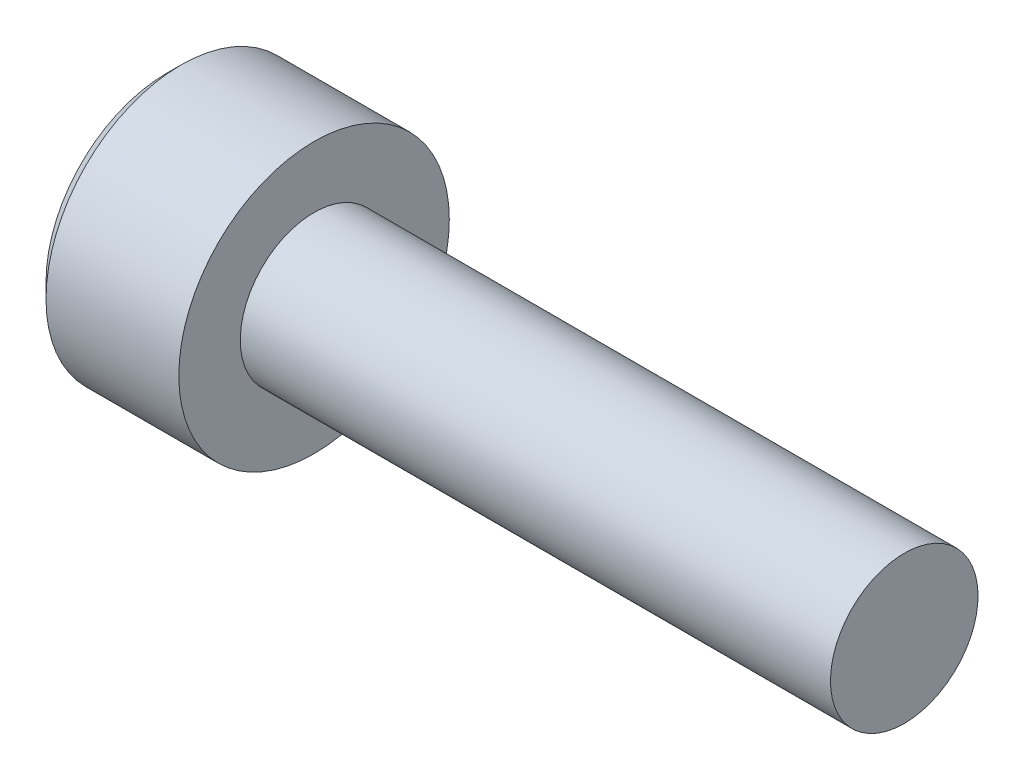
from build123d import *

# Parameters (mm, degrees)
CUT_EXTRUDE1_DEPTH = 1.3
CHAMFER1_SIZE      = 0.3


with BuildPart() as part:
    # Sketch1 → Revolve1 (revolve)
    with BuildSketch(Plane.XY, mode=Mode.PRIVATE) as revolve1_sk:
        Polygon((0, 1.5), (12, 1.5), (12, 0), (-3, 0), (-3, 2.75), (0, 2.75), align=None)
    revolve(revolve1_sk.sketch.rotate(Axis((-3, 0, 0), (1, 0, 0)), 180), axis=Axis((-3, 0, 0), (1, 0, 0)))

    # Sketch2 → Cut-Revolve1 (revolve, cut)
    with BuildSketch(Plane.XY, mode=Mode.PRIVATE) as cut_revolve1_sk:
        Polygon((-0.948924226, 0), (-1.7, 1.25), (-3, 1.25), (-3, 0), align=None)
    revolve(cut_revolve1_sk.sketch.rotate(Axis((-3, 0, 0), (1, 0, 0)), 180), axis=Axis((-3, 0, 0), (1, 0, 0)), mode=Mode.SUBTRACT)

    # Sketch3 → Cut-Extrude1 (cut)
    with BuildSketch(Plane.ZY.offset(3)):
        Polygon((1.25, 0.721687836), (0, 1.443375673), (-1.25, 0.721687836), (-1.25, -0.721687836), (0, -1.443375673), (1.25, -0.721687836), align=None)
    extrude(amount=-CUT_EXTRUDE1_DEPTH, mode=Mode.SUBTRACT)

    # Chamfer1
    chamfer1_edges = [part.edges().sort_by_distance(p)[0] for p in [
        (-3, 2.75, 0),
    ]]
    chamfer(chamfer1_edges, length=CHAMFER1_SIZE)


solid = part.part
